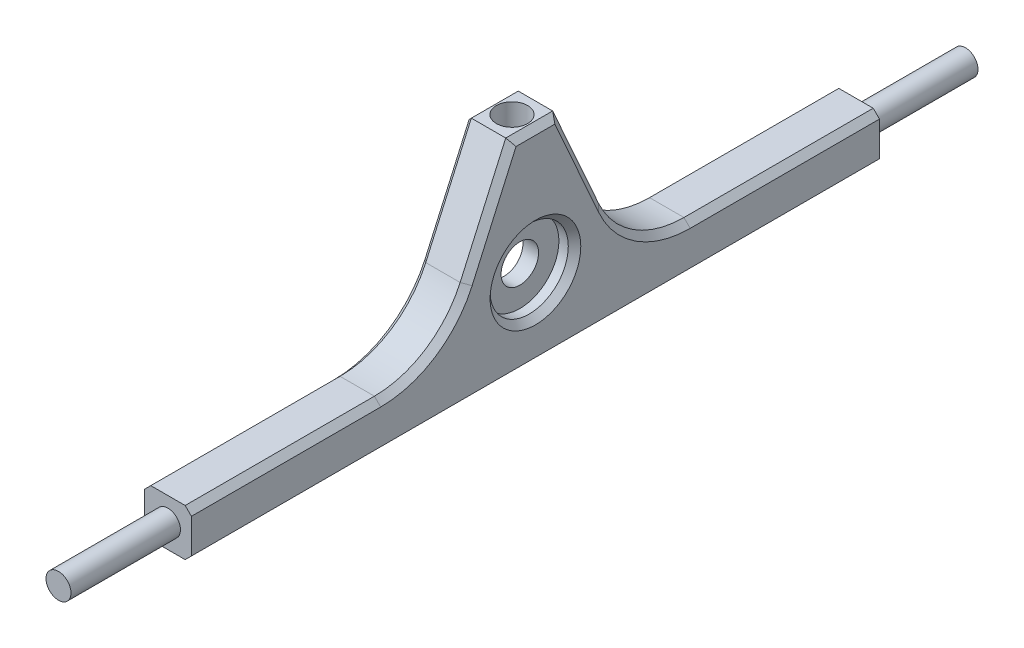
from build123d import *

# Parameters (mm, degrees)
BOSS_EXTRUDE1_DEPTH      = 110
BOSS_EXTRUDE1_DEPTH_BACK = 110
SKETCH1_W                = 15
SKETCH1_H                = 15
SKETCH2_R                = 4
BOSS_EXTRUDE2_DEPTH      = 35
BOSS_EXTRUDE3_START      = 35
SKETCH3_R                = 4
BOSS_EXTRUDE3_DEPTH      = 35
BOSS_EXTRUDE4_DEPTH      = 7.5
BOSS_EXTRUDE4_DEPTH_BACK = 7.5
SKETCH5_R                = 6
CUT_EXTRUDE1_DEPTH       = 157.888495435
SKETCH6_R                = 5
CUT_EXTRUDE5_DEPTH       = 20
SKETCH7_R                = 12.5
CUT_EXTRUDE2_DEPTH       = 5
FILLET2_R                = 30
CHAMFER1_SIZE            = 2


with BuildPart() as part:
    # Sketch1 → Boss-Extrude1 (new, two sides: drawn at the far end of the back side and taken through both)
    with BuildSketch(Plane.XY.offset(-BOSS_EXTRUDE1_DEPTH_BACK)):
        Rectangle(SKETCH1_W, SKETCH1_H)
    extrude(amount=BOSS_EXTRUDE1_DEPTH + BOSS_EXTRUDE1_DEPTH_BACK)

    # Sketch2 → Boss-Extrude2 (add)
    with BuildSketch(Plane.XY.offset(110)):
        Circle(SKETCH2_R)
    extrude(amount=BOSS_EXTRUDE2_DEPTH)

    # Sketch3 → Boss-Extrude3 (add)
    with BuildSketch(Plane(origin=(0, 0, -110), x_dir=(-1, 0, 0), z_dir=(0, 0, -1)).offset(BOSS_EXTRUDE3_START)):
        with Locations(Location((0, 0, 0), (0, 0, 180))):
            Circle(SKETCH3_R)
    extrude(amount=-BOSS_EXTRUDE3_DEPTH)

    # Sketch4 → Boss-Extrude4 (add, two sides: drawn at the far end of the back side and taken through both)
    with BuildSketch(Plane(origin=(0, 0, 0), x_dir=(0, 0, -1), z_dir=(1, 0, 0)).offset(-BOSS_EXTRUDE4_DEPTH_BACK)):
        Polygon((-30, 7.5), (-7.5, 58), (7.5, 58), (30, 7.5), align=None)
    extrude(amount=BOSS_EXTRUDE4_DEPTH + BOSS_EXTRUDE4_DEPTH_BACK)

    # Sketch5 → Cut-Extrude1 (cut, through all)
    with BuildSketch(Plane(origin=(7.5, 0, 0), x_dir=(0, 0, -1), z_dir=(1, 0, 0))):
        with Locations((0, 18)):
            Circle(SKETCH5_R)
    extrude(amount=-CUT_EXTRUDE1_DEPTH, mode=Mode.SUBTRACT)

    # Sketch6 → Cut-Extrude5 (cut)
    with BuildSketch(Plane(origin=(0, 58, 0), x_dir=(1, 0, 0), z_dir=(0, 1, 0))):
        with Locations(Location((0, 0, 0), (0, 0, 270))):
            Circle(SKETCH6_R)
    extrude(amount=-CUT_EXTRUDE5_DEPTH, mode=Mode.SUBTRACT)

    # Sketch7 → Cut-Extrude2 (cut)
    with BuildSketch(Plane(origin=(7.5, 0, 0), x_dir=(0, 0, -1), z_dir=(1, 0, 0))):
        with Locations((0, 18)):
            Circle(SKETCH7_R)
    cut_extrude2 = extrude(amount=-CUT_EXTRUDE2_DEPTH, mode=Mode.SUBTRACT)

    # Mirror1: Cut-Extrude2 across plane
    add(cut_extrude2.mirror(Plane(origin=(0, 0, 0), x_dir=(0, 0, 1), z_dir=(1, 0, 0))), mode=Mode.SUBTRACT)

    # Fillet2
    fillet2_edges = [part.edges().sort_by_distance(p)[0] for p in [
        (0, 7.5, -30),
        (0, 7.5, 30),
    ]]
    fillet(fillet2_edges, radius=FILLET2_R)

    # Chamfer1
    chamfer1_edges = [part.edges().sort_by_distance(p)[0] for p in [
        (-7.5, 41.645338647, 14.786730306),
        (-7.5, 58, 0),
        (7.5, 58, 0),
        (7.5, 41.645338647, 14.786730306),
        (7.5, 18, 12.5),
        (-7.5, 18, 12.5),
        (7.5, 41.645338647, -14.786730306),
        (-7.5, 41.645338647, -14.786730306),
        (-7.5, 7.5, 79.738303565),
        (-7.5, 7.5, -79.738303565),
        (7.5, 7.5, 79.738303565),
        (7.5, 7.5, -79.738303565),
        (7.5, 12.33772982, -33.140752104),
        (-7.5, 12.33772982, -33.140752104),
        (7.5, -7.5, 0),
        (7.5, 12.33772982, 33.140752104),
        (-7.5, 12.33772982, 33.140752104),
        (-7.5, -7.5, 0),
    ]]
    chamfer(chamfer1_edges, length=CHAMFER1_SIZE)


solid = part.part
